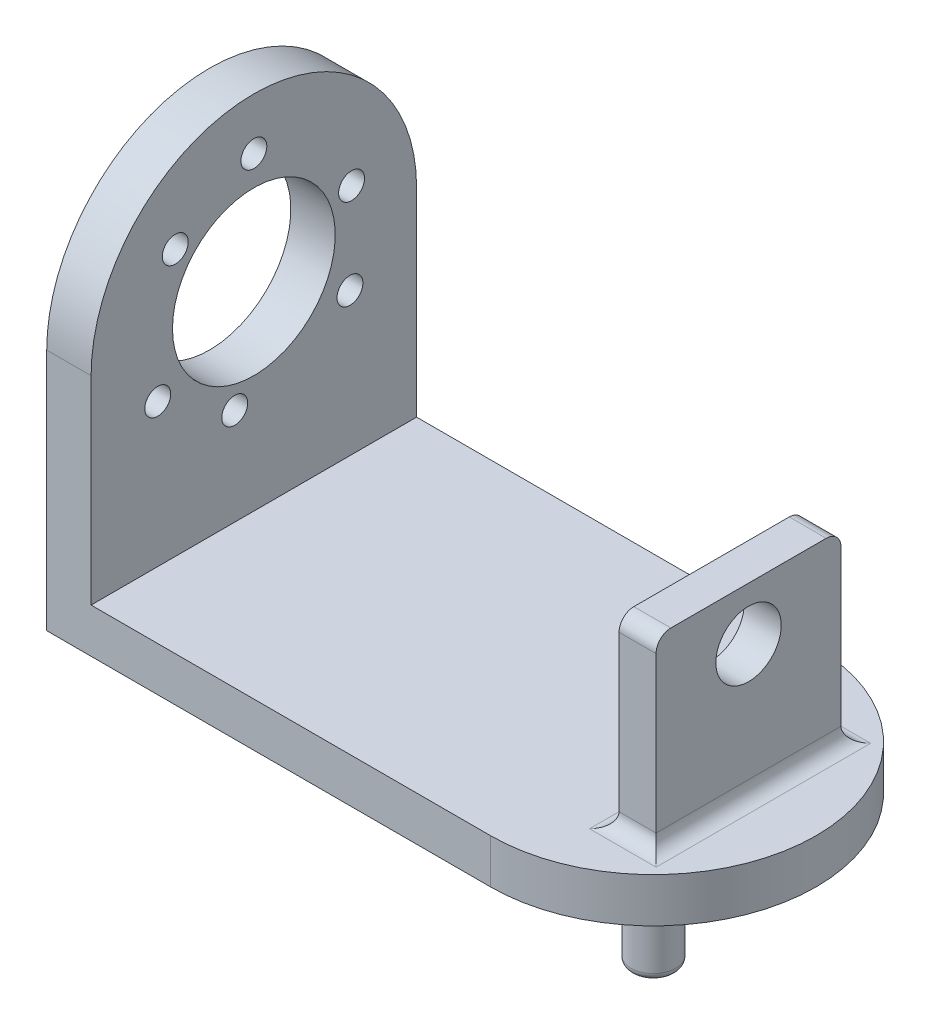
from build123d import *

# Parameters (mm, degrees)
BOSS_EXTRUDE1_DEPTH = 6
BOSS_EXTRUDE2_DEPTH = 6
SKETCH3_R           = 11
SKETCH3_R_2         = 1.75
CUT_EXTRUDE1_DEPTH  = 6
SKETCH4_R           = 3.025
BOSS_EXTRUDE3_DEPTH = 20
FILLET1_R           = 10
FILLET2_R           = 1
SKETCH5_W           = 5
SKETCH5_H           = 25
BOSS_EXTRUDE4_DEPTH = 25
CUT_EXTRUDE2_REACH  = 95.817
SKETCH6_R           = 4.419567015
FILLET3_R           = 2


with BuildPart() as part:
    # Sketch1 → Boss-Extrude1 (new body)
    with BuildSketch(Plane(origin=(0, 0, 0), x_dir=(1, 0, 0), z_dir=(0, 1, 0))):
        with BuildLine():
            Line((0, -22), (-60, -22))
            Line((-60, -22), (-60, 22))
            Line((-60, 22), (0, 22))
            ThreePointArc((0, 22), (22, 0), (0, -22))
        make_face()
    extrude(amount=BOSS_EXTRUDE1_DEPTH)

    # Sketch2 → Boss-Extrude2 (add)
    with BuildSketch(Plane.ZY.offset(60)):
        with BuildLine():
            Line((-22, 6), (-21.999999972, 32.847291098))
            ThreePointArc((-21.999999972, 32.847291098), (-0.000557287, 54.848405664), (22, 32.848405671))
            Line((22, 32.848405671), (22, 6))
            Line((22, 6), (-22, 6))
        make_face()
    extrude(amount=-BOSS_EXTRUDE2_DEPTH)

    # Sketch3 → Cut-Extrude1 (cut)
    with BuildSketch(Plane.ZY.offset(60)):
        with Locations((0, 32.848405671)):
            Circle(SKETCH3_R)
        with Locations((0, 47.848405671)):
            Circle(SKETCH3_R_2)
        with Locations((12.990381057, 25.348405671)):
            Circle(SKETCH3_R_2)
        with Locations((-12.990381057, 25.348405671)):
            Circle(SKETCH3_R_2)
        with Locations((10.623744158, 41.966303458)):
            Circle(SKETCH3_R_2)
        with Locations((2.584459033, 19.089024453)):
            Circle(SKETCH3_R_2)
        with Locations((-13.208203192, 37.489889102)):
            Circle(SKETCH3_R_2)
    extrude(amount=-CUT_EXTRUDE1_DEPTH, mode=Mode.SUBTRACT)

    # Sketch4 → Boss-Extrude3 (add)
    with BuildSketch(Plane.XZ):
        with Locations(Location((0, 0, 0), (0, 0, 90))):
            Circle(SKETCH4_R)
    extrude(amount=BOSS_EXTRUDE3_DEPTH)

    # Fillet1
    fillet1_edges = [part.edges().sort_by_distance(p)[0] for p in [
        (0, 0, -3.025),
    ]]
    fillet(fillet1_edges, radius=FILLET1_R)

    # Fillet2
    fillet2_edges = [part.edges().sort_by_distance(p)[0] for p in [
        (0, -20, -3.025),
    ]]
    fillet(fillet2_edges, radius=FILLET2_R)

    # Sketch5 → Boss-Extrude4 (add)
    with BuildSketch(Plane(origin=(0, 6, 0), x_dir=(1, 0, 0), z_dir=(0, 1, 0))):
        with Locations((10.364576522, 0)):
            Rectangle(SKETCH5_W, SKETCH5_H)
    extrude(amount=BOSS_EXTRUDE4_DEPTH)

    # Sketch6 → Cut-Extrude2 (cut, up to next)
    with BuildSketch(Plane(origin=(12.864576522, 0, 0), x_dir=(0, 0, -1), z_dir=(1, 0, 0)), mode=Mode.PRIVATE) as cut_extrude2_sk1:
        with Locations((0, 23.878810585)):
            Circle(SKETCH6_R)
    cut_extrude2_tool1 = extrude(cut_extrude2_sk1.sketch, amount=-CUT_EXTRUDE2_REACH, mode=Mode.PRIVATE) & part.part
    add(cut_extrude2_tool1.solids().sort_by_distance((12.864577, 23.878811, 0))[0], mode=Mode.SUBTRACT)

    # Fillet3
    fillet3_edges = [part.edges().sort_by_distance(p)[0] for p in [
        (12.864576522, 6, 0),
        (10.364576522, 6, -12.5),
        (7.864576522, 6, 0),
        (10.364576522, 6, 12.5),
        (10.364576522, 31, -12.5),
        (10.364576522, 31, 12.5),
    ]]
    fillet(fillet3_edges, radius=FILLET3_R)


solid = part.part
